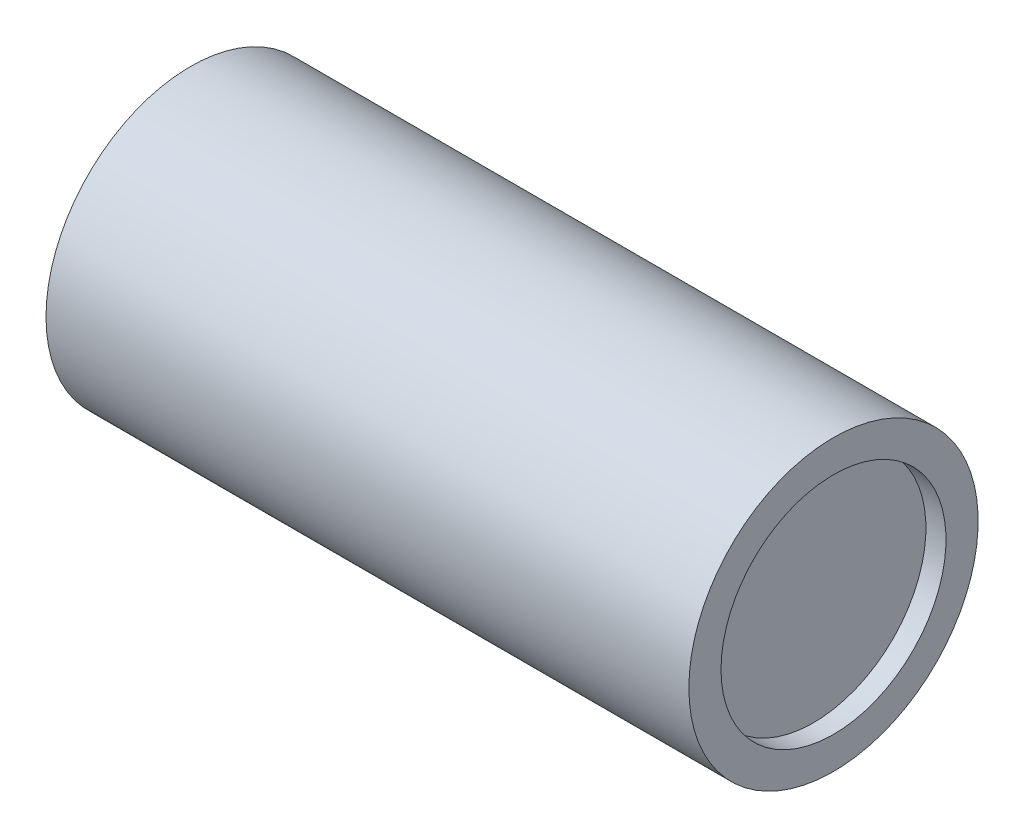
from build123d import *


with BuildPart() as part:
    # Sketch4 → Revolve1 (revolve)
    with BuildSketch(Plane.XY, mode=Mode.PRIVATE) as revolve1_sk:
        Polygon((0, 0), (0, 8.89), (-1.5875, 8.89), (-1.5875, 11.43), (49.2125, 11.43), (49.2125, 8.89), (47.625, 8.89), (47.625, 0), (46.0375, 0), (46.0375, 8.89), (1.5875, 8.89), (1.5875, 0), align=None)
    revolve(revolve1_sk.sketch.rotate(Axis((0, 0, 0), (1, 0, 0)), 90), axis=Axis((0, 0, 0), (1, 0, 0)))


solid = part.part
